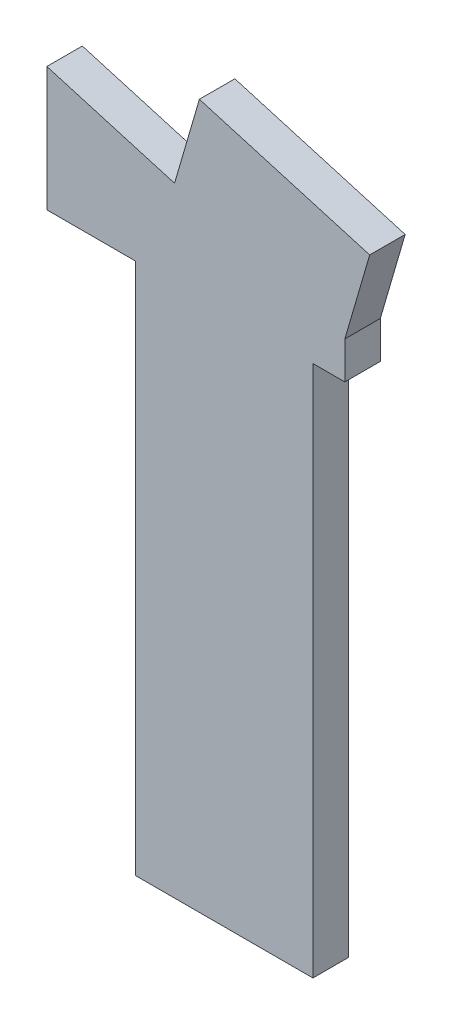
from build123d import *

# Parameters (mm, degrees)
SKETCH2_W           = 10
SKETCH2_H           = 30
BOSS_EXTRUDE1_DEPTH = 2


with BuildPart() as part:
    # Sketch2 → Boss-Extrude1 (new body)
    with BuildSketch(Plane.XY):
        with Locations((10, -15)):
            Rectangle(SKETCH2_W, SKETCH2_H)
        Polygon((0, 7), (0, 0), (5, 0), (15, 0), (16.8, 0), (16.8, 2.1), (7.2, 4.9), align=None)
        Polygon((8.6, 9.7), (7.2, 4.9), (16.8, 2.1), (18.2, 6.9), align=None)
    extrude(amount=BOSS_EXTRUDE1_DEPTH)


solid = part.part
